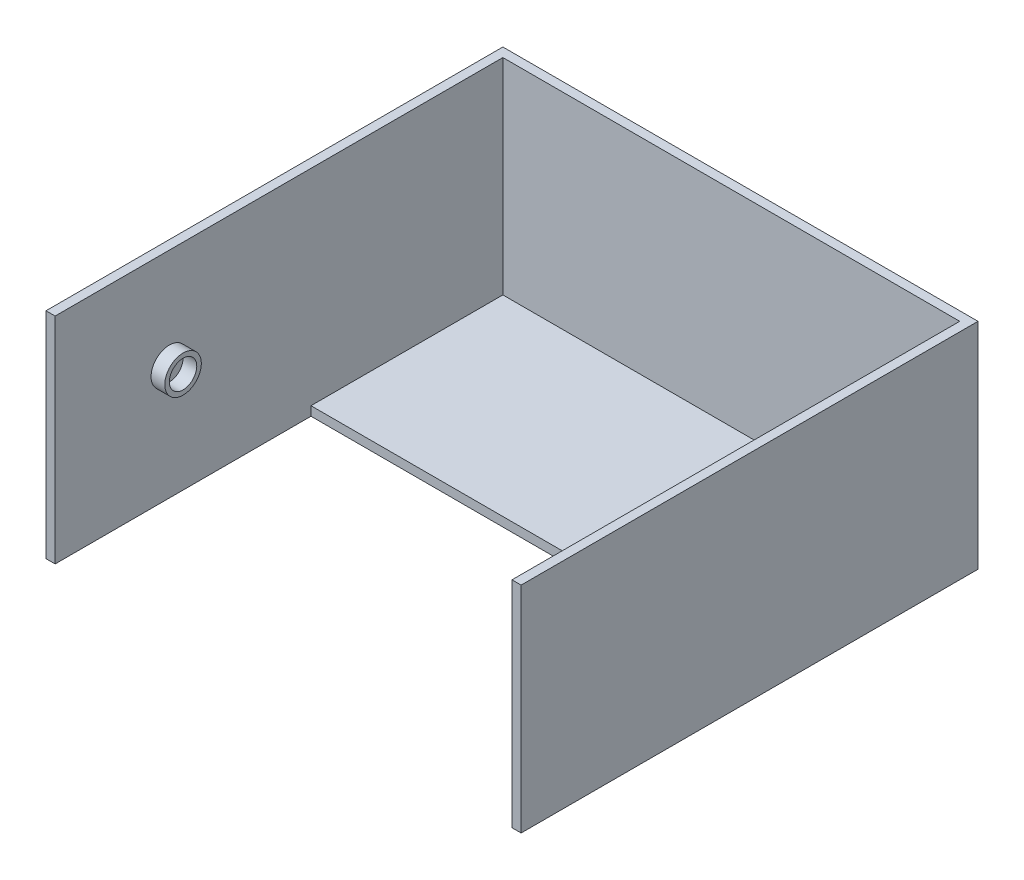
from build123d import *

# Parameters (mm, degrees)
EXTRUDE_1_DEPTH     = 100
SKETCH_5_W          = 100
SKETCH_5_H          = 2
EXTRUDE_1_2_DEPTH   = 45
SKETCH_6_W          = 100
SKETCH_6_H          = 56
CUT_EXTRUDE_1_DEPTH = 124.020020532
SKETCH_7_R          = 4
SKETCH_7_R_2        = 3
EXTRUDE_2_DEPTH     = 3


with BuildPart() as part:
    # 草图1 → Extrude 1 (new body)
    with BuildSketch(Plane.XY):
        Polygon((-48.242261061, 18.127395065), (-48.242261061, -28.872604935), (55.757738939, -28.872604935), (55.757738939, 18.127395065), (53.757738939, 18.127395065), (53.757738939, -26.872604935), (-46.242261061, -26.872604935), (-46.242261061, 18.127395065), align=None)
    extrude(amount=-EXTRUDE_1_DEPTH)

    # 草图5 → Extrude 1 2 (add)
    with BuildSketch(Plane(origin=(0, -26.872604935, 0), x_dir=(1, 0, 0), z_dir=(0, 1, 0))):
        with Locations((3.757738939, 99)):
            Rectangle(SKETCH_5_W, SKETCH_5_H)
    extrude(amount=EXTRUDE_1_2_DEPTH)

    # 草图6 → 切除-拉伸1 (cut, through all)
    with BuildSketch(Plane(origin=(0, -26.872604935, 0), x_dir=(1, 0, 0), z_dir=(0, 1, 0))):
        with Locations((3.757738939, 28)):
            Rectangle(SKETCH_6_W, SKETCH_6_H)
    extrude(amount=-CUT_EXTRUDE_1_DEPTH, mode=Mode.SUBTRACT)

    # 草图7 → 拉伸-薄壁2 (add)
    with BuildSketch(Plane(origin=(-46.242261061, 0, 0), x_dir=(0, 0, -1), z_dir=(1, 0, 0))):
        with Locations((25, -3.872604935)):
            Circle(SKETCH_7_R)
        with Locations((25, -3.872604935)):
            Circle(SKETCH_7_R_2, mode=Mode.SUBTRACT)
    extrude_2 = extrude(amount=EXTRUDE_2_DEPTH)

    # 镜向1: 拉伸-薄壁2 across plane
    add(extrude_2.mirror(Plane(origin=(3.757738939, 0, 0), x_dir=(0, 0, 1), z_dir=(1, 0, 0))))


solid = part.part
